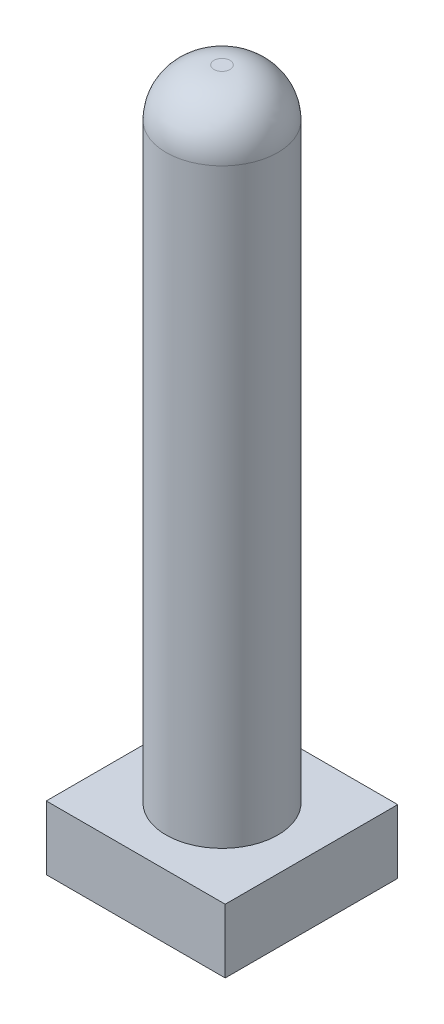
from build123d import *

# Parameters (mm, degrees)
SKETCH1_W           = 5.6
SKETCH1_H           = 5.4
BOSS_EXTRUDE1_DEPTH = 2
SKETCH3_R           = 0.95
CUT_EXTRUDE2_DEPTH  = 9.5
SKETCH7_R           = 1.2
CUT_EXTRUDE4_DEPTH  = 2.8
SKETCH2_R           = 1.75
BOSS_EXTRUDE2_DEPTH = 20
FILLET2_R           = 1.5
SKETCH8_R           = 0.95
CUT_EXTRUDE5_DEPTH  = 9.5


with BuildPart() as part:
    # Sketch1 → Boss-Extrude1 (new body)
    with BuildSketch(Plane(origin=(0, 0, 0), x_dir=(1, 0, 0), z_dir=(0, 1, 0))):
        Rectangle(SKETCH1_W, SKETCH1_H)
    extrude(amount=BOSS_EXTRUDE1_DEPTH)

    # Sketch3 → Cut-Extrude2 (cut)
    with BuildSketch(Plane.XZ):
        with Locations(Location((0, 0, 0), (0, 0, 270))):
            Circle(SKETCH3_R)
    extrude(amount=-CUT_EXTRUDE2_DEPTH, mode=Mode.SUBTRACT)

    # Sketch7 → Cut-Extrude4 (cut)
    with BuildSketch(Plane.XZ):
        with Locations(Location((0, 0, 0), (0, 0, 270))):
            Circle(SKETCH7_R)
    extrude(amount=-CUT_EXTRUDE4_DEPTH, mode=Mode.SUBTRACT)

    # Sketch2 → Boss-Extrude2 (add)
    with BuildSketch(Plane(origin=(0, 2, 0), x_dir=(1, 0, 0), z_dir=(0, 1, 0))):
        with Locations(Location((0, 0, 0), (0, 0, 90))):
            Circle(SKETCH2_R)
    extrude(amount=BOSS_EXTRUDE2_DEPTH)

    # Fillet2
    fillet2_edges = [part.edges().sort_by_distance(p)[0] for p in [
        (0, 22, 1.75),
    ]]
    fillet(fillet2_edges, radius=FILLET2_R)

    # Sketch8 → Cut-Extrude5 (cut)
    with BuildSketch(Plane.XZ):
        with Locations(Location((0, 0, 0), (0, 0, 270))):
            Circle(SKETCH8_R)
    extrude(amount=-CUT_EXTRUDE5_DEPTH, mode=Mode.SUBTRACT)


solid = part.part
